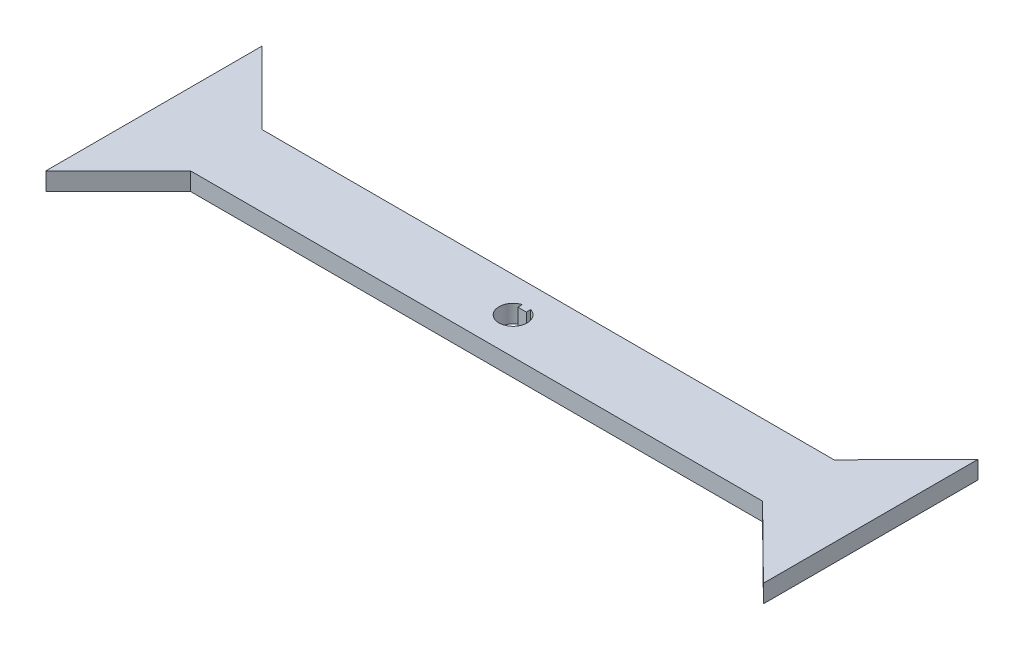
from build123d import *

# Parameters (mm, degrees)
BOSS_EXTRUDE2_DEPTH = 6.35


with BuildPart() as part:
    # Sketch1 → Boss-Extrude2 (new body)
    with BuildSketch(Plane(origin=(0, 0, 0), x_dir=(1, 0, 0), z_dir=(0, 1, 0))):
        Polygon((0, 51.029291752), (0, -25.629291752), (25.629291752, 0), (228.829291752, 0), (254.229291752, -25.094710057), (254.229291752, 51.105289943), (228.829291752, 25.4), (25.629291752, 25.4), align=None)
        with BuildLine():
            Line((125.729291752, 17.77498595), (125.729291752, 16.205289943))
            Line((125.729291752, 16.205289943), (128.729291752, 16.205289943))
            Line((128.729291752, 16.205289943), (128.729291752, 17.77498595))
            ThreePointArc((128.729291752, 17.77498595), (127.229291752, 8.005289943), (125.729291752, 17.77498595))
        make_face(mode=Mode.SUBTRACT)
    extrude(amount=BOSS_EXTRUDE2_DEPTH)


solid = part.part
